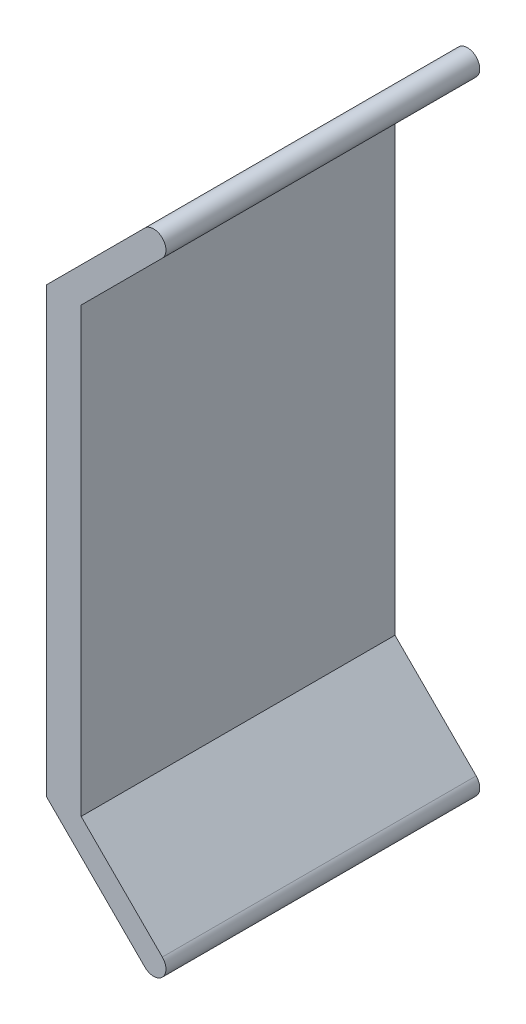
from build123d import *

# Parameters (mm, degrees)
SALIENTE_EXTRUIR1_DEPTH = 50
CORTAR_EXTRUIR3_DEPTH   = 5


with BuildPart() as part:
    # Croquis1 → Saliente-Extruir1 (new body)
    with BuildSketch(Plane.XY):
        with BuildLine():
            Line((-5, 31.75), (-5, -31.75))
            Line((-5, -31.75), (9.142135624, -45.892135624))
            ThreePointArc((9.142135624, -45.892135624), (11.642135624, -45.892135624), (11.642135624, -43.392135624))
            Line((11.642135624, -43.392135624), (0, -31.75))
            Line((0, -31.75), (0, 31.75))
            Line((0, 31.75), (11.642135624, 43.392135624))
            ThreePointArc((11.642135624, 43.392135624), (11.642135624, 45.892135624), (9.142135624, 45.892135624))
            Line((9.142135624, 45.892135624), (-5, 31.75))
        make_face()
    extrude(amount=SALIENTE_EXTRUIR1_DEPTH)

    # Croquis4 → Cortar-Extruir3 (cut)
    with BuildSketch(Plane(origin=(0, 0, 0), x_dir=(-1, 0, 0), z_dir=(0, 0, -1))):
        with BuildLine():
            Line((5, 31.75), (-9.142135624, 45.892135624))
            ThreePointArc((-9.142135624, 45.892135624), (-11.642135624, 45.892135624), (-11.642135624, 43.392135624))
            Line((-11.642135624, 43.392135624), (0, 31.75))
            Line((0, 31.75), (0, -31.75))
            Line((0, -31.75), (-11.642135624, -43.392135624))
            ThreePointArc((-11.642135624, -43.392135624), (-11.642135624, -45.892135624), (-9.142135624, -45.892135624))
            Line((-9.142135624, -45.892135624), (5, -31.75))
            Line((5, -31.75), (5, 31.75))
        make_face()
    extrude(amount=-CORTAR_EXTRUIR3_DEPTH, mode=Mode.SUBTRACT)


solid = part.part
